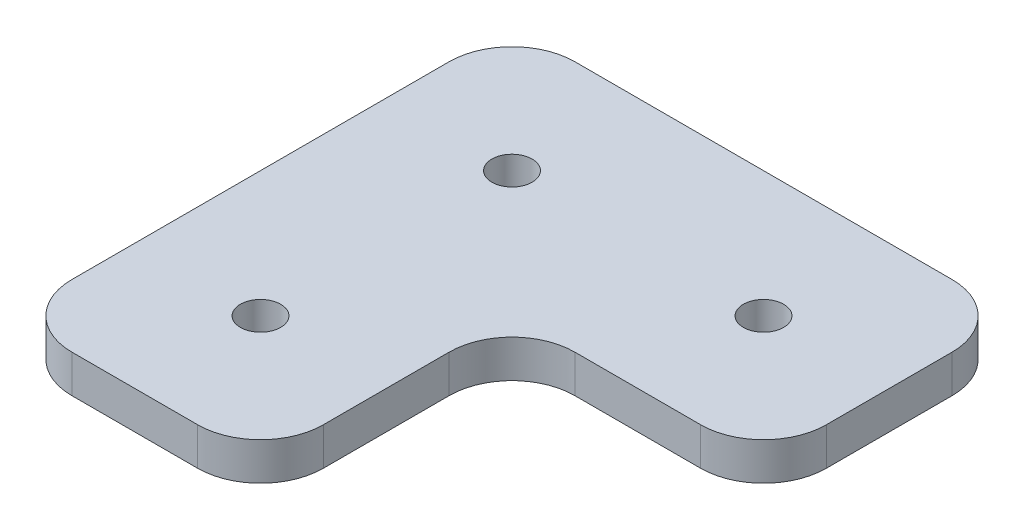
from build123d import *

# Parameters (mm, degrees)
SKETCH_1_R      = 1.6
EXTRUDE_1_DEPTH = 3
FILLET_1_R      = 5


with BuildPart() as part:
    # 草图1 → 凸台-拉伸1 (new body)
    with BuildSketch(Plane(origin=(0, 0, 0), x_dir=(1, 0, 0), z_dir=(0, 1, 0))):
        Polygon((0, 0), (0, 40), (40, 40), (40, 20), (20, 20), (20, 0), align=None)
        with Locations(Location((30, 30, 0), (0, 0, 270))):
            Circle(SKETCH_1_R, mode=Mode.SUBTRACT)
        with Locations(Location((10, 30, 0), (0, 0, 270))):
            Circle(SKETCH_1_R, mode=Mode.SUBTRACT)
        with Locations(Location((10, 10, 0), (0, 0, 270))):
            Circle(SKETCH_1_R, mode=Mode.SUBTRACT)
    extrude(amount=EXTRUDE_1_DEPTH)

    # 圆角1
    fillet_1_edges = [part.edges().sort_by_distance(p)[0] for p in [
        (0, 1.5, 0),
        (0, 1.5, -40),
        (40, 1.5, -40),
        (40, 1.5, -20),
        (20, 1.5, -20),
        (20, 1.5, 0),
    ]]
    fillet(fillet_1_edges, radius=FILLET_1_R)


solid = part.part
